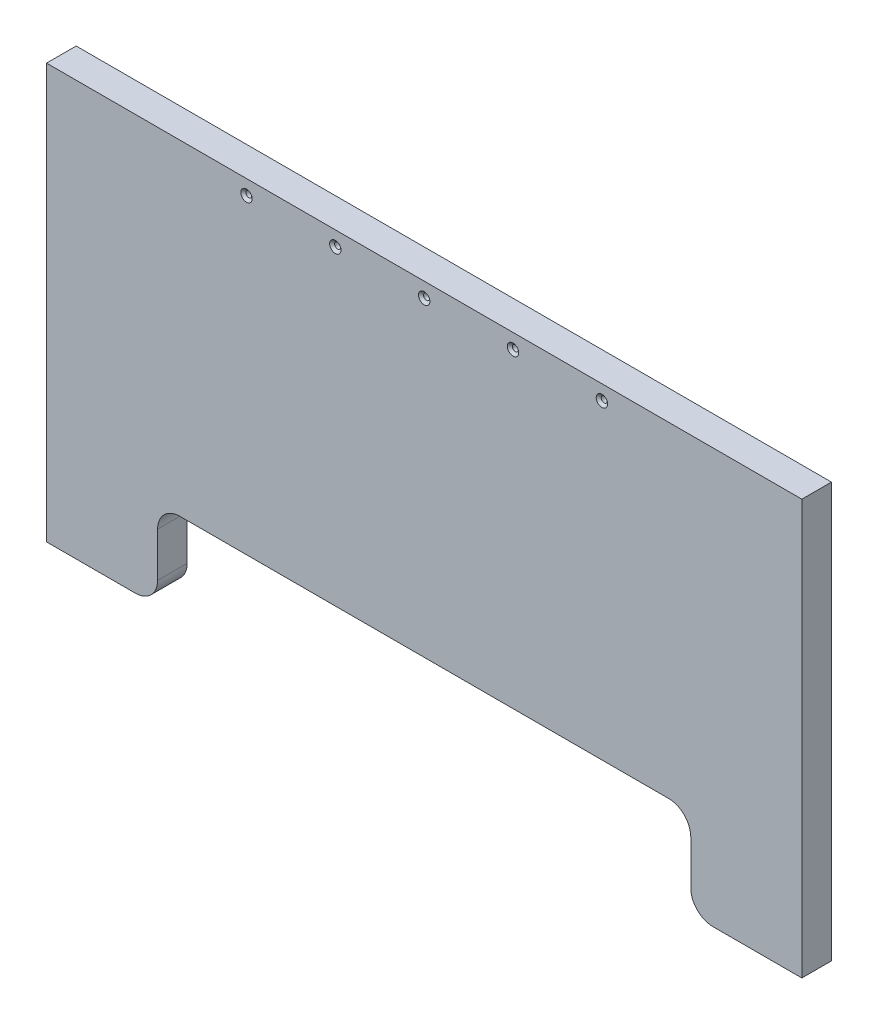
from build123d import *

# Parameters (mm, degrees)
BOSS_EXTRUDE1_DEPTH                                = 25.4
FILLET1_R                                          = 19.05
CSK_FOR_10_FLAT_HEAD_MACHINE_SCREW_100_D           = 5.1054
CSK_FOR_10_FLAT_HEAD_MACHINE_SCREW_100_CSINK_D     = 9.779
CSK_FOR_10_FLAT_HEAD_MACHINE_SCREW_100_CSINK_ANGLE = 100


with BuildPart() as part:
    # Sketch1 → Boss-Extrude1 (new body)
    with BuildSketch(Plane.XY):
        Polygon((-323.85, 279.4), (323.85, 279.4), (323.85, -76.2), (228.6, -76.2), (228.6, 0), (-228.6, 0), (-228.6, -76.2), (-323.85, -76.2), align=None)
    extrude(amount=BOSS_EXTRUDE1_DEPTH)

    # Fillet1
    fillet1_edges = [part.edges().sort_by_distance(p)[0] for p in [
        (228.6, -76.2, 12.7),
        (228.6, 0, 12.7),
        (-228.6, 0, 12.7),
        (-228.6, -76.2, 12.7),
    ]]
    fillet(fillet1_edges, radius=FILLET1_R)

    # CSK for #10 Flat Head Machine Screw (100)1 (through all)
    with Locations(Plane.XY.offset(25.4)):
        with Locations((0, 266.7), (76.2, 266.7), (152.4, 266.7), (-76.2, 266.7), (-152.4, 266.7)):
            CounterSinkHole(CSK_FOR_10_FLAT_HEAD_MACHINE_SCREW_100_D / 2, CSK_FOR_10_FLAT_HEAD_MACHINE_SCREW_100_CSINK_D / 2, counter_sink_angle=CSK_FOR_10_FLAT_HEAD_MACHINE_SCREW_100_CSINK_ANGLE)


solid = part.part
